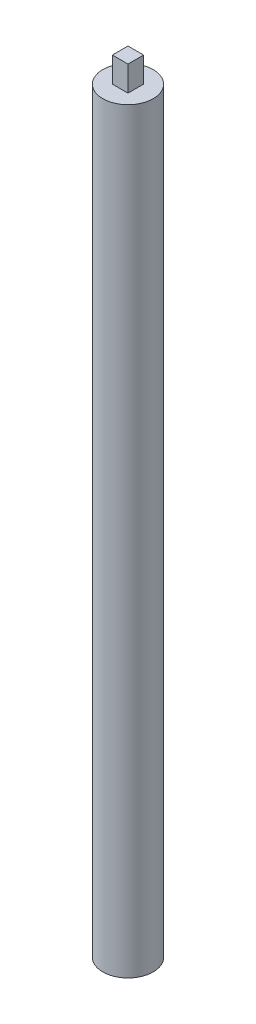
from build123d import *

# Parameters (mm, degrees)
SKETCH1_R           = 12.7
BOSS_EXTRUDE1_DEPTH = 381
SKETCH2_W           = 7.873679476
SKETCH2_H           = 7.870049084
BOSS_EXTRUDE2_DEPTH = 12.7


with BuildPart() as part:
    # Sketch1 → Boss-Extrude1 (new body)
    with BuildSketch(Plane(origin=(0, 0, 0), x_dir=(1, 0, 0), z_dir=(0, 1, 0))):
        with Locations(Location((0, 0, 0), (0, 0, 270))):
            Circle(SKETCH1_R)
    extrude(amount=BOSS_EXTRUDE1_DEPTH)

    # Sketch2 → Boss-Extrude2 (add)
    with BuildSketch(Plane(origin=(0, 381, 0), x_dir=(1, 0, 0), z_dir=(0, 1, 0))):
        Rectangle(SKETCH2_W, SKETCH2_H)
    extrude(amount=BOSS_EXTRUDE2_DEPTH)


solid = part.part
